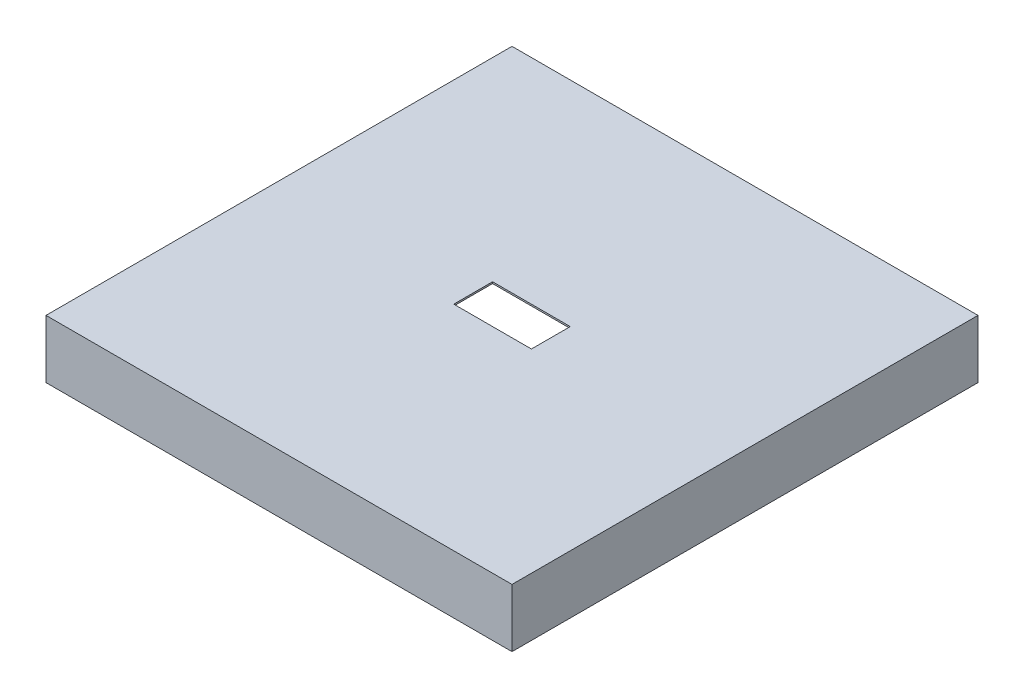
from build123d import *

# Parameters (mm, degrees)
SKETCH1_W           = 3657.6
SKETCH1_H           = 3657.6
SKETCH1_W_2         = 3479.8
SKETCH1_H_2         = 3479.8
BOSS_EXTRUDE1_DEPTH = 444.5
SKETCH2_W           = 3657.6
SKETCH2_H           = 3657.6
BOSS_EXTRUDE2_DEPTH = 12.7
SKETCH3_W           = 609.6
SKETCH3_H           = 304.8
CUT_EXTRUDE1_DEPTH  = 2627.414041997


with BuildPart() as part:
    # Sketch1 → Boss-Extrude1 (new body)
    with BuildSketch(Plane(origin=(0, 0, 0), x_dir=(1, 0, 0), z_dir=(0, 1, 0))):
        Rectangle(SKETCH1_W, SKETCH1_H)
        Rectangle(SKETCH1_W_2, SKETCH1_H_2, mode=Mode.SUBTRACT)
    extrude(amount=BOSS_EXTRUDE1_DEPTH)

    # Sketch2 → Boss-Extrude2 (add)
    with BuildSketch(Plane(origin=(0, 444.5, 0), x_dir=(1, 0, 0), z_dir=(0, 1, 0))):
        Rectangle(SKETCH2_W, SKETCH2_H)
    extrude(amount=BOSS_EXTRUDE2_DEPTH)

    # Sketch3 → Cut-Extrude1 (cut, through all)
    with BuildSketch(Plane(origin=(0, 457.2, 0), x_dir=(1, 0, 0), z_dir=(0, 1, 0))):
        Rectangle(SKETCH3_W, SKETCH3_H)
    extrude(amount=-CUT_EXTRUDE1_DEPTH, mode=Mode.SUBTRACT)


solid = part.part
